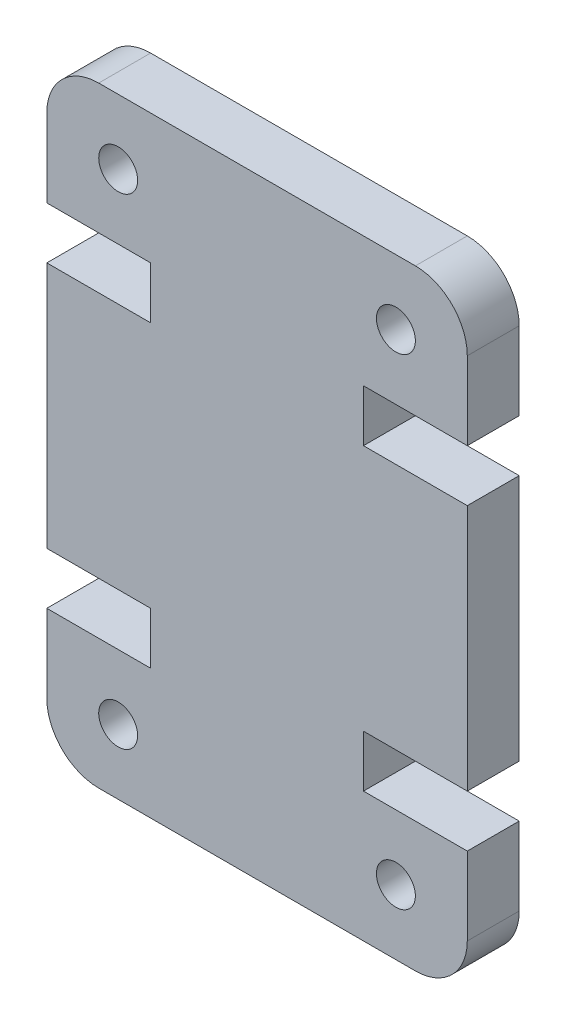
from build123d import *

# Parameters (mm, degrees)
SKETCH1_R           = 0.75
BOSS_EXTRUDE1_DEPTH = 2


with BuildPart() as part:
    # Sketch1 → Boss-Extrude1 (new body)
    with BuildSketch(Plane.XY):
        with BuildLine():
            Line((16.2, 5), (16.2, 2))
            ThreePointArc((16.2, 2), (15.614213562, 0.585786438), (14.2, 0))
            Line((14.2, 0), (2, 0))
            ThreePointArc((2, 0), (0.585786438, 0.585786438), (0, 2))
            Line((0, 2), (0, 5))
            Line((0, 5), (4, 5))
            Line((4, 5), (4, 7))
            Line((4, 7), (0, 7))
            Line((0, 7), (0, 16.525))
            Line((0, 16.525), (4, 16.525))
            Line((4, 16.525), (4, 18.525))
            Line((4, 18.525), (0, 18.525))
            Line((0, 18.525), (0, 21.525))
            ThreePointArc((0, 21.525), (0.585786438, 22.939213562), (2, 23.525))
            Line((2, 23.525), (14.2, 23.525))
            ThreePointArc((14.2, 23.525), (15.614213562, 22.939213562), (16.2, 21.525))
            Line((16.2, 21.525), (16.2, 18.525))
            Line((16.2, 18.525), (12.2, 18.525))
            Line((12.2, 18.525), (12.2, 16.525))
            Line((12.2, 16.525), (16.2, 16.525))
            Line((16.2, 16.525), (16.2, 7))
            Line((16.2, 7), (12.2, 7))
            Line((12.2, 7), (12.2, 5))
            Line((12.2, 5), (16.2, 5))
        make_face()
        with Locations(Location((13.45, 2.5, 0), (0, 0, 180))):
            Circle(SKETCH1_R, mode=Mode.SUBTRACT)
        with Locations(Location((2.75, 21.025, 0), (0, 0, 180))):
            Circle(SKETCH1_R, mode=Mode.SUBTRACT)
        with Locations((13.45, 21.025)):
            Circle(SKETCH1_R, mode=Mode.SUBTRACT)
        with Locations((2.75, 2.5)):
            Circle(SKETCH1_R, mode=Mode.SUBTRACT)
    extrude(amount=BOSS_EXTRUDE1_DEPTH)


solid = part.part
